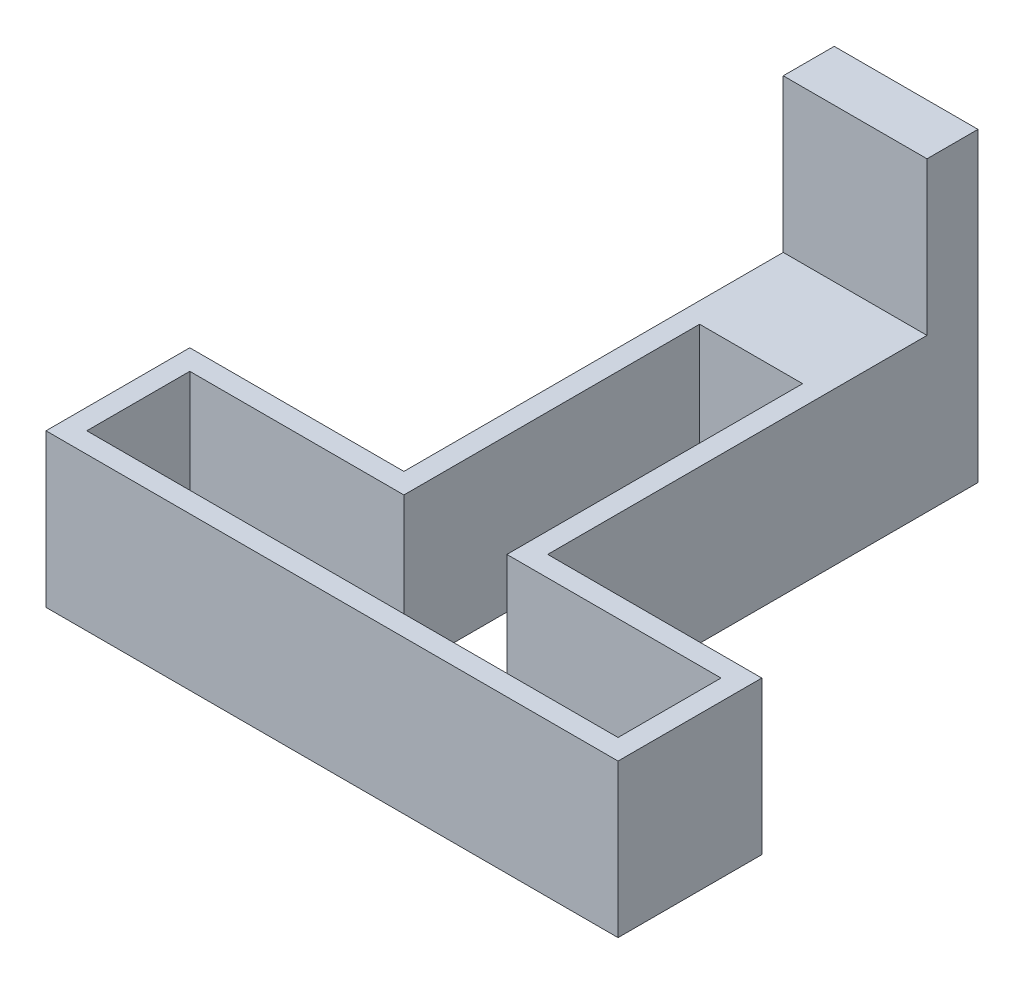
from build123d import *

# Parameters (mm, degrees)
AUFSATZ_LINEAR_AUSTRAGEN1_DEPTH = 15
SKIZZE2_W                       = 14.1
SKIZZE2_H                       = 5
AUFSATZ_LINEAR_AUSTRAGEN2_DEPTH = 15
SKIZZE3_W                       = 14.1
SKIZZE3_H                       = 15.2
AUFSATZ_LINEAR_AUSTRAGEN3_DEPTH = 15


with BuildPart() as part:
    # Skizze1 → Aufsatz-Linear austragen1 (new body)
    with BuildSketch(Plane(origin=(0, 0, 0), x_dir=(1, 0, 0), z_dir=(0, 1, 0))):
        Polygon((-2, 12.1), (-2, -2), (54.1, -2), (54.1, 12.1), (33.1, 12.1), (33.1, 54.3), (19, 54.3), (19, 12.1), align=None)
        Polygon((0, 0), (52.1, 0), (52.1, 10.1), (31.1, 10.1), (31.1, 52.3), (21, 52.3), (21, 10.1), (0, 10.1), align=None, mode=Mode.SUBTRACT)
    extrude(amount=AUFSATZ_LINEAR_AUSTRAGEN1_DEPTH)

    # Skizze2 → Aufsatz-Linear austragen2 (add)
    with BuildSketch(Plane(origin=(0, 15, 0), x_dir=(1, 0, 0), z_dir=(0, 1, 0))):
        with Locations((26.05, 51.8)):
            Rectangle(SKIZZE2_W, SKIZZE2_H)
    extrude(amount=AUFSATZ_LINEAR_AUSTRAGEN2_DEPTH)

    # Skizze3 → Aufsatz-Linear austragen3 (add)
    with BuildSketch(Plane.XZ):
        with Locations((26.05, -46.7)):
            Rectangle(SKIZZE3_W, SKIZZE3_H)
    extrude(amount=-AUFSATZ_LINEAR_AUSTRAGEN3_DEPTH)


solid = part.part
